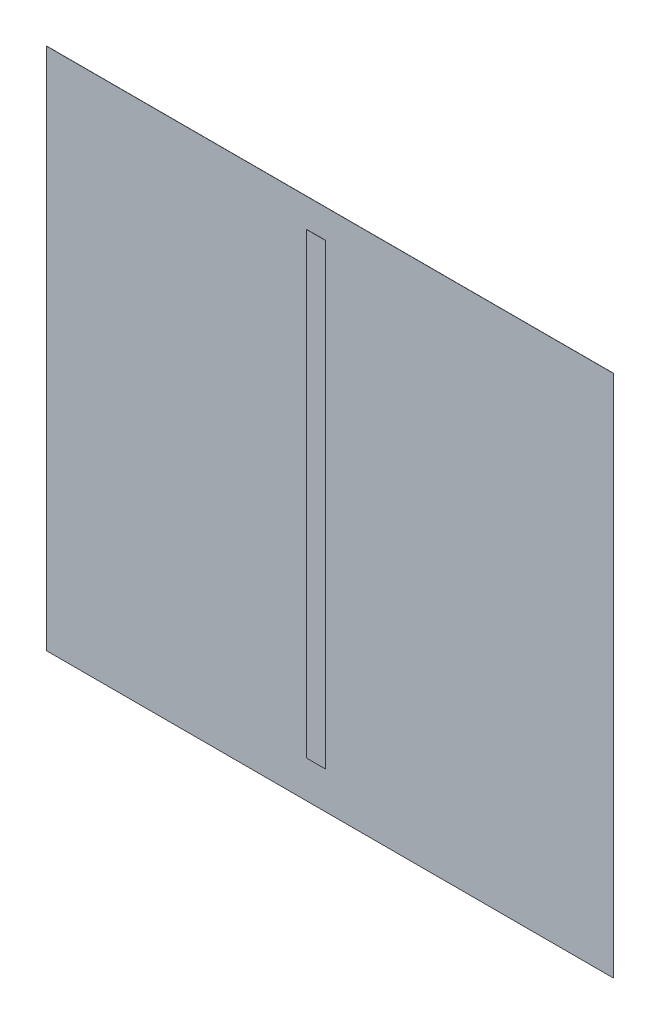
from build123d import *

# Parameters (mm, degrees)
SKETCH_2_W      = 4.098
SKETCH_2_H      = 100
EXTRUDE_1_DEPTH = 0.035
SKETCH_6_W      = 123.821295425
SKETCH_6_H      = 114.396561675
EXTRUDE_4_DEPTH = 0.035


with BuildPart() as part:
    # Эскиз2 → Бобышка-Вытянуть1 (new body)
    with BuildSketch(Plane.XY):
        with Locations((2.049, -17.469779106)):
            Rectangle(SKETCH_2_W, SKETCH_2_H)
    extrude(amount=EXTRUDE_1_DEPTH)


with BuildPart() as body_2:
    # Эскиз6 → Бобышка-Вытянуть4 (new body)
    with BuildSketch(Plane(origin=(0, 0, -1), x_dir=(-1, 0, 0), z_dir=(0, 0, -1))):
        with Locations((-4.031023099, -19.402482236)):
            Rectangle(SKETCH_6_W, SKETCH_6_H)
    extrude(amount=EXTRUDE_4_DEPTH)


solid = Compound([part.part, body_2.part])
